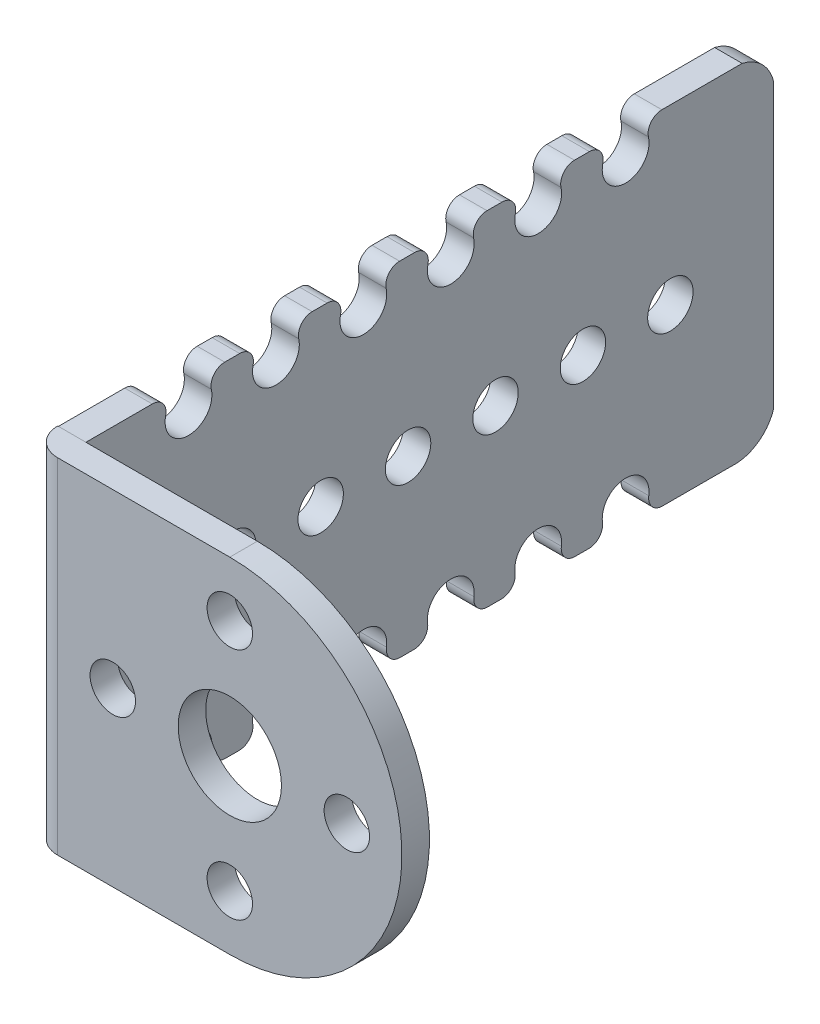
from build123d import *

# Parameters (mm, degrees)
CROQUIS1_R              = 3.75
CROQUIS1_R_2            = 1.65
SALIENTE_EXTRUIR1_DEPTH = 2
SALIENTE_EXTRUIR2_DEPTH = 2
CROQUIS5_R              = 1.65
CROQUIS5_R_2            = 1.7
CORTAR_EXTRUIR2_DEPTH   = 10
REDONDEO3_R             = 1
REDONDEO4_R             = 1
REDONDEO5_R             = 1
REDONDEO6_R             = 1
REDONDEO7_R             = 1
REDONDEO8_R             = 1
REDONDEO12_R            = 2


with BuildPart() as part:
    # Croquis1 → Saliente-Extruir1 (new body)
    with BuildSketch(Plane.XY):
        with BuildLine():
            Line((0, 0), (0, 25))
            Line((0, 25), (14.5, 25))
            ThreePointArc((14.5, 25), (27, 12.5), (14.5, 0))
            Line((14.5, 0), (0, 0))
        make_face()
        with Locations((14.5, 12.5)):
            Circle(CROQUIS1_R, mode=Mode.SUBTRACT)
        with Locations((14.5, 21)):
            Circle(CROQUIS1_R_2, mode=Mode.SUBTRACT)
        with Locations((23, 12.5)):
            Circle(CROQUIS1_R_2, mode=Mode.SUBTRACT)
        with Locations((14.5, 4)):
            Circle(CROQUIS1_R_2, mode=Mode.SUBTRACT)
        with Locations((6, 12.5)):
            Circle(CROQUIS1_R_2, mode=Mode.SUBTRACT)
    extrude(amount=SALIENTE_EXTRUIR1_DEPTH)

    # Croquis4 → Saliente-Extruir2 (add)
    with BuildSketch(Plane.ZY):
        with BuildLine():
            Line((2, 0), (-46.922808665, 0))
            ThreePointArc((-46.922808665, 0), (-48.82286243, 0.503124666), (-50, 2.077191335))
            Line((-50, 2.077191335), (-50, 22.665501207))
            ThreePointArc((-50, 22.665501207), (-49.183232344, 24.133251816), (-47.715481735, 24.950019472))
            Line((-47.715481735, 24.950019472), (2, 24.950019472))
            Line((2, 24.950019472), (2, 0))
        make_face()
    extrude(amount=-SALIENTE_EXTRUIR2_DEPTH)

    # Croquis5 → Cortar-Extruir2 (cut)
    with BuildSketch(Plane(origin=(2, 0, 0), x_dir=(0, 0, -1), z_dir=(1, 0, 0))):
        with Locations((42.5, 12.371346271)):
            Circle(CROQUIS5_R)
        with Locations((36.15, 12.371346271)):
            Circle(CROQUIS5_R)
        with Locations((29.8, 12.371346271)):
            Circle(CROQUIS5_R)
        with Locations((23.45, 12.371346271)):
            Circle(CROQUIS5_R)
        with Locations((17.1, 12.371346271)):
            Circle(CROQUIS5_R)
        with Locations((10.75, 12.371346271)):
            Circle(CROQUIS5_R)
        with Locations((4.4, 12.371346271)):
            Circle(CROQUIS5_R)
        with Locations((7.5, 23.35)):
            Circle(CROQUIS5_R_2)
        with Locations((13.85, 23.35)):
            Circle(CROQUIS5_R_2)
        with Locations((20.2, 23.35)):
            Circle(CROQUIS5_R_2)
        with Locations((26.55, 23.35)):
            Circle(CROQUIS5_R_2)
        with Locations((32.9, 23.35)):
            Circle(CROQUIS5_R_2)
        with Locations((39.25, 23.35)):
            Circle(CROQUIS5_R_2)
        with Locations((39.25, 1.392692542)):
            Circle(CROQUIS5_R_2)
        with Locations((32.9, 1.392692542)):
            Circle(CROQUIS5_R_2)
        with Locations((26.55, 1.392692542)):
            Circle(CROQUIS5_R_2)
        with Locations((20.2, 1.392692542)):
            Circle(CROQUIS5_R_2)
        with Locations((13.85, 1.392692542)):
            Circle(CROQUIS5_R_2)
        with Locations((7.5, 1.392692542)):
            Circle(CROQUIS5_R_2)
    extrude(amount=-CORTAR_EXTRUIR2_DEPTH, mode=Mode.SUBTRACT)

    # Redondeo3
    redondeo3_edges = [part.edges().sort_by_distance(p)[0] for p in [
        (1, 24.950019472, -8.074402028),
        (1, 24.950019472, -13.275597972),
    ]]
    fillet(redondeo3_edges, radius=REDONDEO3_R)

    # Redondeo4
    redondeo4_edges = [part.edges().sort_by_distance(p)[0] for p in [
        (1, 24.950019472, -19.625597972),
        (1, 24.950019472, -20.774402028),
        (1, 24.950019472, -25.975597972),
        (1, 24.950019472, -14.424402028),
    ]]
    fillet(redondeo4_edges, radius=REDONDEO4_R)

    # Redondeo5
    redondeo5_edges = [part.edges().sort_by_distance(p)[0] for p in [
        (1, 24.950019472, -32.325597972),
        (1, 24.950019472, -33.474402028),
        (1, 24.950019472, -38.675597972),
        (1, 24.950019472, -39.824402028),
        (1, 24.950019472, -27.124402028),
    ]]
    fillet(redondeo5_edges, radius=REDONDEO5_R)

    # Redondeo6
    redondeo6_edges = [part.edges().sort_by_distance(p)[0] for p in [
        (1, 24.950019472, -6.925597972),
    ]]
    fillet(redondeo6_edges, radius=REDONDEO6_R)

    # Redondeo7
    redondeo7_edges = [part.edges().sort_by_distance(p)[0] for p in [
        (1, 0, -31.925111553),
        (1, 0, -25.575111553),
        (1, 0, -27.524888447),
        (1, 0, -19.225111553),
        (1, 0, -21.174888447),
        (1, 0, -12.875111553),
        (1, 0, -14.824888447),
        (1, 0, -6.525111553),
        (1, 0, -8.474888447),
    ]]
    fillet(redondeo7_edges, radius=REDONDEO7_R)

    # Redondeo8
    redondeo8_edges = [part.edges().sort_by_distance(p)[0] for p in [
        (1, 0, -38.275111553),
        (1, 0, -40.224888447),
        (1, 0, -33.874888447),
    ]]
    fillet(redondeo8_edges, radius=REDONDEO8_R)

    # Redondeo12
    redondeo12_edges = [part.edges().sort_by_distance(p)[0] for p in [
        (0, 12.5, 2),
    ]]
    fillet(redondeo12_edges, radius=REDONDEO12_R)


solid = part.part
